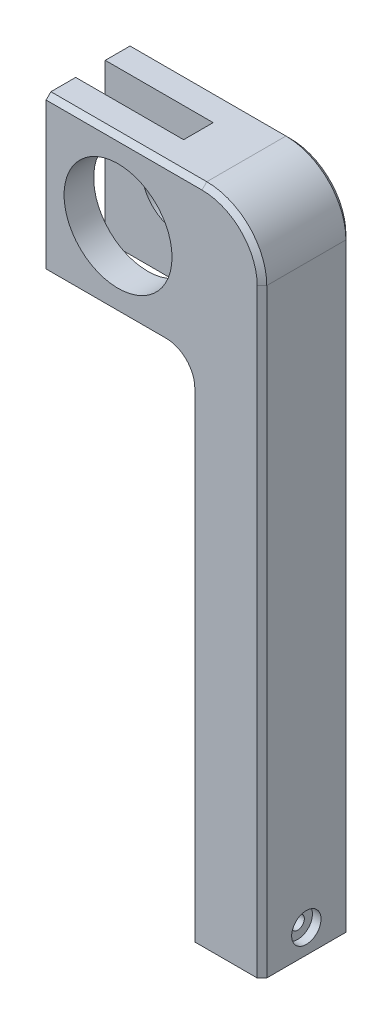
from build123d import *

# Parameters (mm, degrees)
BOSS_EXTRUDE1_DEPTH                     = 18.5
CUT_EXTRUDE1_REACH                      = 291.944
SKETCH3_W                               = 45
SKETCH3_H                               = 12.33
FILLET1_R                               = 25
FILLET2_R                               = 10
SKETCH4_R                               = 22.5
CUT_EXTRUDE2_DEPTH                      = 12.335
CUT_EXTRUDE3_REACH                      = 293.709
SKETCH5_R                               = 14.625
CHAMFER1_SIZE                           = 2
CBORE_FOR_M5_HEX_HEAD_BOLT1_D           = 5.5
CBORE_FOR_M5_HEX_HEAD_BOLT1_CBORE_D     = 12.24
CBORE_FOR_M5_HEX_HEAD_BOLT1_CBORE_DEPTH = 3.58
F_3_0MM_DOWEL_HOLE1_D                   = 3
F_3_0MM_DOWEL_HOLE1_DEPTH               = 20
F_3_0MM_DOWEL_HOLE1_TIP                 = 0.901290929


with BuildPart() as part:
    # Sketch1 → Boss-Extrude1 (new, symmetric)
    with BuildSketch(Plane.XY):
        Polygon((0, 0), (-30, 0), (-30, 210), (-90, 210), (-90, 275), (0, 275), align=None)
    extrude(amount=BOSS_EXTRUDE1_DEPTH, both=True)

    # Sketch3 → Cut-Extrude1 (cut, up to next)
    with BuildSketch(Plane(origin=(0, 275, 0), x_dir=(1, 0, 0), z_dir=(0, 1, 0)), mode=Mode.PRIVATE) as cut_extrude1_sk1:
        with Locations((-67.5, 0)):
            Rectangle(SKETCH3_W, SKETCH3_H)
    cut_extrude1_tool1 = extrude(cut_extrude1_sk1.sketch, amount=-CUT_EXTRUDE1_REACH, mode=Mode.PRIVATE) & part.part
    add(cut_extrude1_tool1.solids().sort_by_distance((-67.5, 275, 0))[0], mode=Mode.SUBTRACT)

    # Fillet1
    fillet1_edges = [part.edges().sort_by_distance(p)[0] for p in [
        (0, 275, 0),
    ]]
    fillet(fillet1_edges, radius=FILLET1_R)

    # Fillet2
    fillet2_edges = [part.edges().sort_by_distance(p)[0] for p in [
        (-30, 210, 0),
    ]]
    fillet(fillet2_edges, radius=FILLET2_R)

    # Sketch4 → Cut-Extrude2 (cut)
    with BuildSketch(Plane.XY.offset(18.5)):
        with Locations((-60, 242.5)):
            Circle(SKETCH4_R)
    extrude(amount=-CUT_EXTRUDE2_DEPTH, mode=Mode.SUBTRACT)

    # Sketch5 → Cut-Extrude3 (cut, up to next)
    with BuildSketch(Plane(origin=(0, 0, -18.5), x_dir=(-1, 0, 0), z_dir=(0, 0, -1)), mode=Mode.PRIVATE) as cut_extrude3_sk1:
        with Locations((60, 242.5)):
            Circle(SKETCH5_R)
    cut_extrude3_tool1 = extrude(cut_extrude3_sk1.sketch, amount=-CUT_EXTRUDE3_REACH, mode=Mode.PRIVATE) & part.part
    add(cut_extrude3_tool1.solids().sort_by_distance((-60, 242.5, -18.5))[0], mode=Mode.SUBTRACT)

    # Chamfer1
    chamfer1_edges = [part.edges().sort_by_distance(p)[0] for p in [
        (-65, 210, -18.5),
        (-57.5, 275, 18.5),
        (-7.32233047, 267.67766953, 18.5),
        (-57.5, 275, -18.5),
        (-7.32233047, 267.67766953, -18.5),
        (-30, 100, 18.5),
        (-30, 100, -18.5),
        (-32.928932188, 207.071067812, 18.5),
        (-32.928932188, 207.071067812, -18.5),
        (0, 125, -18.5),
        (-65, 210, 18.5),
        (0, 125, 18.5),
    ]]
    chamfer(chamfer1_edges, length=CHAMFER1_SIZE)

    # CBORE for M5 Hex Head Bolt1 (through all)
    with Locations(Plane(origin=(0, 0, 0), x_dir=(0, 0, -1), z_dir=(1, 0, 0))):
        with Locations((0, 10)):
            CounterBoreHole(CBORE_FOR_M5_HEX_HEAD_BOLT1_D / 2, CBORE_FOR_M5_HEX_HEAD_BOLT1_CBORE_D / 2, CBORE_FOR_M5_HEX_HEAD_BOLT1_CBORE_DEPTH)

    # Ø3.0mm Dowel Hole1
    with Locations(Plane.ZY.offset(90)):
        with Locations((12.33, 270), (-12.33, 215), (-12.33, 270), (12.33, 215)):
            Hole(F_3_0MM_DOWEL_HOLE1_D / 2, depth=F_3_0MM_DOWEL_HOLE1_DEPTH)
            with Locations((0, 0, -(F_3_0MM_DOWEL_HOLE1_DEPTH + F_3_0MM_DOWEL_HOLE1_TIP / 2))):  # 118° drill point
                Cone(0, F_3_0MM_DOWEL_HOLE1_D / 2, F_3_0MM_DOWEL_HOLE1_TIP, mode=Mode.SUBTRACT)


solid = part.part
